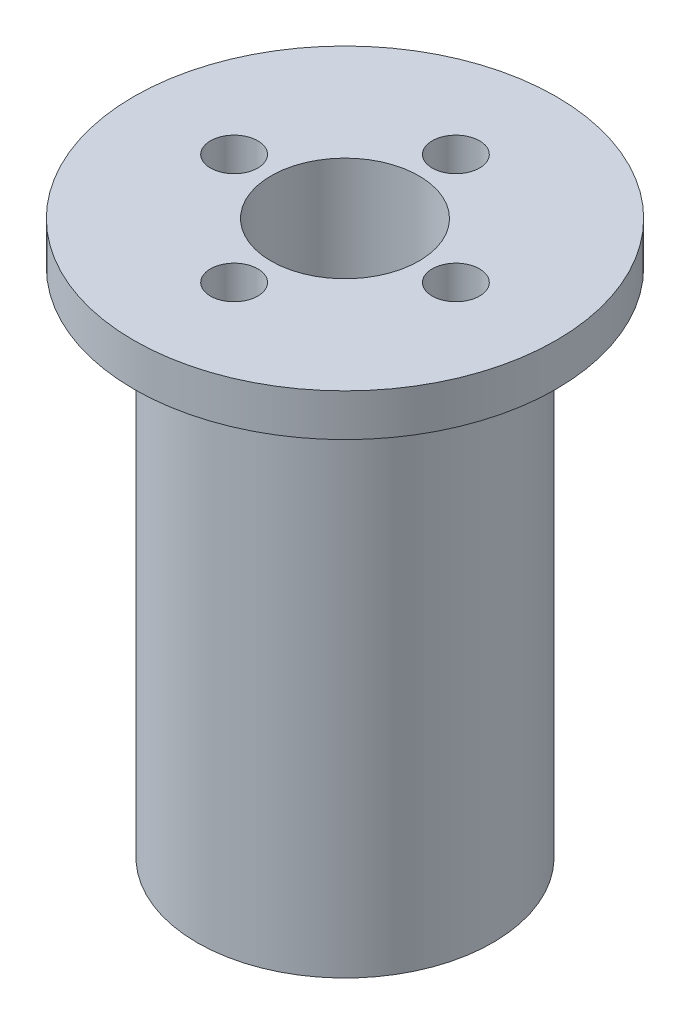
from build123d import *

# Parameters (mm, degrees)
SKIZZE5_R                       = 2.8
SCHNITT_LINEAR_AUSTRAGEN1_DEPTH = 15
SCHNITT_LINEAR_START            = -15
SKIZZE7_R                       = 2.8
SCHNITT_LINEAR_AUSTRAGEN2_DEPTH = 15


with BuildPart() as part:
    # Skizze4 → Rotation1 (revolve)
    with BuildSketch(Plane(origin=(0, 0, 0), x_dir=(0, 0, -1), z_dir=(1, 0, 0)), mode=Mode.PRIVATE) as rotation1_sk:
        Polygon((8.75, 0), (25, 0), (25, -5), (19.5, -5), (19.5, -6), (17.5, -6), (17.5, -65.5), (8.75, -65.5), align=None)
    revolve(rotation1_sk.sketch.rotate(Axis((0, 0, 0), (0, -1, 0)), 180), axis=Axis((0, 0, 0), (0, -1, 0)))

    # Skizze5 → Schnitt-Linear austragen1 (cut)
    with BuildSketch(Plane(origin=(0, 0, 0), x_dir=(1, 0, 0), z_dir=(0, 1, 0))):
        with Locations(Location((0, 13.125, 0), (0, 0, 270))):
            Circle(SKIZZE5_R)
        with Locations(Location((13.125, 0, 0), (0, 0, 270))):
            Circle(SKIZZE5_R)
        with Locations(Location((0, -13.125, 0), (0, 0, 270))):
            Circle(SKIZZE5_R)
        with Locations(Location((-13.125, 0, 0), (0, 0, 270))):
            Circle(SKIZZE5_R)
    extrude(amount=-SCHNITT_LINEAR_AUSTRAGEN1_DEPTH, mode=Mode.SUBTRACT)

    # Skizze7 → Schnitt-Linear austragen2 (cut)
    with BuildSketch(Plane.XZ.offset(65.5).offset(SCHNITT_LINEAR_START)):
        with Locations(Location((13.125, 0, 0), (0, 0, 90))):
            Circle(SKIZZE7_R)
        with Locations(Location((0, -13.125, 0), (0, 0, 90))):
            Circle(SKIZZE7_R)
        with Locations(Location((-13.125, 0, 0), (0, 0, 90))):
            Circle(SKIZZE7_R)
        with BuildLine():
            ThreePointArc((0, 15.925), (-2.8, 13.125), (0, 10.325))
            Line((0, 10.325), (0, 15.925))
        make_face()
        with BuildLine():
            Line((0, 15.925), (0, 10.325))
            ThreePointArc((0, 10.325), (1.979898987, 11.145101013), (2.8, 13.125))
            ThreePointArc((2.8, 13.125), (1.979898987, 15.104898987), (0, 15.925))
        make_face()
    extrude(amount=SCHNITT_LINEAR_AUSTRAGEN2_DEPTH, mode=Mode.SUBTRACT)


solid = part.part
